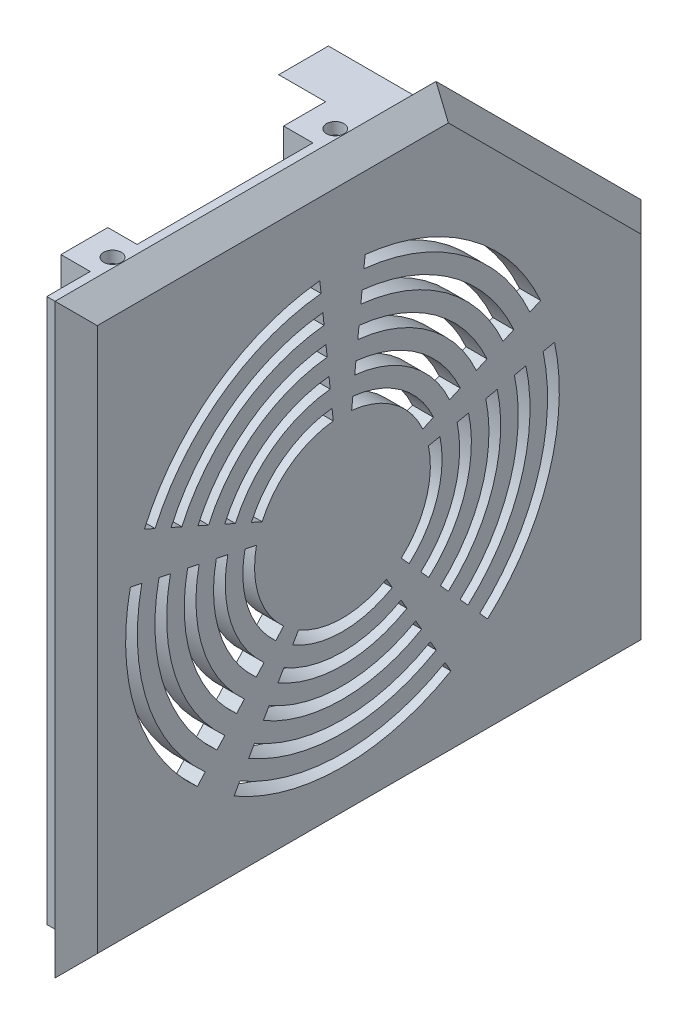
from build123d import *

# Parameters (mm, degrees)
BOSS_EXTRUDE1_DEPTH       = 3.6
BOSS_EXTRUDE1_TAPER       = 45
EXTRUDE_THIN2_DEPTH       = 5
SKETCH5_W                 = 8
SKETCH5_H                 = 8
BOSS_EXTRUDE2_DEPTH       = 10
CUT_EXTRUDE1_DEPTH        = 4
F_3_0MM_DOWEL_HOLE1_D     = 3
F_3_0MM_DOWEL_HOLE1_DEPTH = 8
F_3_0MM_DOWEL_HOLE1_TIP   = 0.901290929
SKETCH11_W                = 8
SKETCH11_H                = 8
BOSS_EXTRUDE3_DEPTH       = 10
CUT_EXTRUDE2_DEPTH        = 4
F_3_0MM_DOWEL_HOLE2_D     = 3
F_3_0MM_DOWEL_HOLE2_DEPTH = 8
F_3_0MM_DOWEL_HOLE2_TIP   = 0.901290929
BOSS_EXTRUDE4_DEPTH       = 18
CUT_EXTRUDE3_DEPTH        = 6
CUT_EXTRUDE4_DEPTH        = 3.6


with BuildPart() as part:
    # Sketch1 → Boss-Extrude1 (new body)
    with BuildSketch(Plane(origin=(0, 0, 0), x_dir=(0, 0, -1), z_dir=(1, 0, 0))):
        Polygon((-8.447488584, 4.892694064), (-8.447488584, -95.107305936), (91.552511416, -95.107305936), (91.552511416, -30.107305936), (56.552511416, 4.892694064), align=None)
    extrude(amount=BOSS_EXTRUDE1_DEPTH, taper=BOSS_EXTRUDE1_TAPER)

    # Sketch2 → Extrude-Thin2 (add)
    with BuildSketch(Plane.ZY):
        Polygon((-56.192713441, 1.292694064), (4.847488584, 1.292694064), (4.847488584, -91.507305936), (-87.952511416, -91.507305936), (-87.952511416, -30.467103911), align=None)
        Polygon((-54.535859191, -2.707305936), (0.847488584, -2.707305936), (0.847488584, -87.507305936), (-83.952511416, -87.507305936), (-83.952511416, -32.12395816), align=None, mode=Mode.SUBTRACT)
    extrude(amount=EXTRUDE_THIN2_DEPTH)

    # Sketch5 → Boss-Extrude2 (add)
    with BuildSketch(Plane.ZY):
        with Locations((-66.552511416, -87.507305936)):
            Rectangle(SKETCH5_W, SKETCH5_H)
        with Locations((-16.552511416, -87.507305936)):
            Rectangle(SKETCH5_W, SKETCH5_H)
    extrude(amount=BOSS_EXTRUDE2_DEPTH)

    # Sketch6 → Cut-Extrude1 (cut)
    with BuildSketch(Plane(origin=(0, -85.507305936, 0), x_dir=(1, 0, 0), z_dir=(0, 1, 0))):
        Polygon((-10, 69.552511416), (-3.732050808, 69.552511416), (-2, 66.552511416), (-3.732050808, 63.552511416), (-10, 63.552511416), align=None)
        Polygon((-10, 19.552511416), (-3.732050808, 19.552511416), (-2, 16.552511416), (-3.732050808, 13.552511416), (-10, 13.552511416), align=None)
    extrude(amount=-CUT_EXTRUDE1_DEPTH, mode=Mode.SUBTRACT)

    # Ø3.0mm Dowel Hole1
    with Locations(Plane(origin=(0, -91.507305936, 0), x_dir=(-1, 0, 0), z_dir=(0, -1, 0))):
        with Locations((5.2, 66.552511416), (5.2, 16.552511416)):
            Hole(F_3_0MM_DOWEL_HOLE1_D / 2, depth=F_3_0MM_DOWEL_HOLE1_DEPTH)
            with Locations((0, 0, -(F_3_0MM_DOWEL_HOLE1_DEPTH + F_3_0MM_DOWEL_HOLE1_TIP / 2))):  # 118° drill point
                Cone(0, F_3_0MM_DOWEL_HOLE1_D / 2, F_3_0MM_DOWEL_HOLE1_TIP, mode=Mode.SUBTRACT)

    # Sketch11 → Boss-Extrude3 (add)
    with BuildSketch(Plane.ZY):
        with Locations((-6.552511416, -2.707305936)):
            Rectangle(SKETCH11_W, SKETCH11_H)
        with Locations((-44.552511416, -2.707305936)):
            Rectangle(SKETCH11_W, SKETCH11_H)
    extrude(amount=BOSS_EXTRUDE3_DEPTH)

    # Sketch13 → Cut-Extrude2 (cut)
    with BuildSketch(Plane(origin=(0, -0.707305936, 0), x_dir=(1, 0, 0), z_dir=(0, 1, 0))):
        Polygon((-10, 9.552511416), (-3.732050808, 9.552511416), (-2, 6.552511416), (-3.732050808, 3.552511416), (-10, 3.552511416), align=None)
        Polygon((-10, 47.552511416), (-3.732050808, 47.552511416), (-2, 44.552511416), (-3.732050808, 41.552511416), (-10, 41.552511416), align=None)
    extrude(amount=-CUT_EXTRUDE2_DEPTH, mode=Mode.SUBTRACT)

    # Ø3.0mm Dowel Hole2
    with Locations(Plane(origin=(0, 1.292694064, 0), x_dir=(1, 0, 0), z_dir=(0, 1, 0))):
        with Locations((-122.185263722, 54.052726222), (-5.2, 44.552511416), (-5.2, 6.552511416)):
            Hole(F_3_0MM_DOWEL_HOLE2_D / 2, depth=F_3_0MM_DOWEL_HOLE2_DEPTH)
            with Locations((0, 0, -(F_3_0MM_DOWEL_HOLE2_DEPTH + F_3_0MM_DOWEL_HOLE2_TIP / 2))):  # 118° drill point
                Cone(0, F_3_0MM_DOWEL_HOLE2_D / 2, F_3_0MM_DOWEL_HOLE2_TIP, mode=Mode.SUBTRACT)

    # Sketch16 → Boss-Extrude4 (add)
    with BuildSketch(Plane.ZY):
        Polygon((-47.707432067, 1.292694064), (-87.952511416, -38.952385285), (-87.952511416, -30.467103911), (-56.192713441, 1.292694064), align=None)
    extrude(amount=BOSS_EXTRUDE4_DEPTH)

    # Sketch17 → Cut-Extrude3 (cut)
    with BuildSketch(Plane.ZY.offset(18)):
        Polygon((-57.223370023, -2.849232356), (-55.809156461, -4.263445918), (-82.396371434, -30.850660891), (-83.810584996, -29.436447328), align=None)
    extrude(amount=-CUT_EXTRUDE3_DEPTH, mode=Mode.SUBTRACT)

    # Sketch18 → Cut-Extrude4 (cut)
    with BuildSketch(Plane.ZY):
        with BuildLine():
            Line((-29.489824704, -60.844573588), (-28.489824704, -62.576624396))
            ThreePointArc((-28.489824704, -62.576624396), (-36.989824704, -64.854192532), (-45.489824704, -62.576624396))
            Line((-45.489824704, -62.576624396), (-44.489824704, -60.844573588))
            ThreePointArc((-44.489824704, -60.844573588), (-36.989824704, -62.854192532), (-29.489824704, -60.844573588))
        make_face()
        with BuildLine():
            Line((-26.989824704, -65.174700607), (-25.989824704, -66.906751415))
            ThreePointArc((-25.989824704, -66.906751415), (-36.989824704, -69.854192532), (-47.989824704, -66.906751415))
            Line((-47.989824704, -66.906751415), (-46.989824704, -65.174700607))
            ThreePointArc((-46.989824704, -65.174700607), (-36.989824704, -67.854192532), (-26.989824704, -65.174700607))
        make_face()
        with BuildLine():
            Line((-24.489824704, -69.504827626), (-23.489824704, -71.236878434))
            ThreePointArc((-23.489824704, -71.236878434), (-36.989824704, -74.854192532), (-50.489824704, -71.236878434))
            Line((-50.489824704, -71.236878434), (-49.489824704, -69.504827626))
            ThreePointArc((-49.489824704, -69.504827626), (-36.989824704, -72.854192532), (-24.489824704, -69.504827626))
        make_face()
        with BuildLine():
            Line((-21.989824704, -73.834954645), (-20.989824704, -75.567005453))
            ThreePointArc((-20.989824704, -75.567005453), (-36.989824704, -79.854192532), (-52.989824704, -75.567005453))
            Line((-52.989824704, -75.567005453), (-51.989824704, -73.834954645))
            ThreePointArc((-51.989824704, -73.834954645), (-36.989824704, -77.854192532), (-21.989824704, -73.834954645))
        make_face()
        with BuildLine():
            Line((-19.489824704, -78.165081664), (-18.489824704, -79.897132472))
            ThreePointArc((-18.489824704, -79.897132472), (-36.989824704, -84.854192532), (-55.489824704, -79.897132472))
            Line((-55.489824704, -79.897132472), (-54.489824704, -78.165081664))
            ThreePointArc((-54.489824704, -78.165081664), (-36.989824704, -82.854192532), (-19.489824704, -78.165081664))
        make_face()
        with BuildLine():
            Line((-47.026783799, -59.001364914), (-48.365045012, -60.487654565))
            ThreePointArc((-48.365045012, -60.487654565), (-53.157785481, -53.107481436), (-53.618333916, -44.319693788))
            Line((-53.618333916, -44.319693788), (-51.662038715, -44.735517169))
            ThreePointArc((-51.662038715, -44.735517169), (-51.255672448, -52.489447447), (-47.026783799, -59.001364914))
        make_face()
        with BuildLine():
            Line((-50.372436831, -62.717089041), (-51.710698043, -64.203378692))
            ThreePointArc((-51.710698043, -64.203378692), (-57.913068062, -54.652566408), (-58.50907192, -43.280135334))
            Line((-58.50907192, -43.280135334), (-56.552776718, -43.695958715))
            ThreePointArc((-56.552776718, -43.695958715), (-56.010955029, -54.034532419), (-50.372436831, -62.717089041))
        make_face()
        with BuildLine():
            Line((-53.718089863, -66.432813168), (-55.056351075, -67.919102819))
            ThreePointArc((-55.056351075, -67.919102819), (-62.668350643, -56.19765138), (-63.399809923, -42.240576879))
            Line((-63.399809923, -42.240576879), (-61.443514722, -42.656400261))
            ThreePointArc((-61.443514722, -42.656400261), (-60.766237611, -55.579617391), (-53.718089863, -66.432813168))
        make_face()
        with BuildLine():
            Line((-57.063742894, -70.148537296), (-58.402004107, -71.634826947))
            ThreePointArc((-58.402004107, -71.634826947), (-67.423633225, -57.742736352), (-68.290547927, -41.201018425))
            Line((-68.290547927, -41.201018425), (-66.334252726, -41.616841807))
            ThreePointArc((-66.334252726, -41.616841807), (-65.521520192, -57.124702363), (-57.063742894, -70.148537296))
        make_face()
        with BuildLine():
            Line((-60.409395926, -73.864261423), (-61.747657139, -75.350551074))
            ThreePointArc((-61.747657139, -75.350551074), (-72.178915806, -59.287821323), (-73.181285931, -40.161459971))
            Line((-73.181285931, -40.161459971), (-71.224990729, -40.577283353))
            ThreePointArc((-71.224990729, -40.577283353), (-70.276802774, -58.669787335), (-60.409395926, -73.864261423))
        make_face()
        with BuildLine():
            Line((-50.693006568, -41.753142885), (-52.520097483, -40.939669599))
            ThreePointArc((-52.520097483, -40.939669599), (-46.982173993, -34.100903627), (-38.766808579, -30.94732031))
            Line((-38.766808579, -30.94732031), (-38.557751653, -32.936364101))
            ThreePointArc((-38.557751653, -32.936364101), (-45.806603488, -35.718937616), (-50.693006568, -41.753142885))
        make_face()
        with BuildLine():
            Line((-55.260733856, -39.71945967), (-57.087824772, -38.905986384))
            ThreePointArc((-57.087824772, -38.905986384), (-49.921100254, -30.055818655), (-39.289450895, -25.974710833))
            Line((-39.289450895, -25.974710833), (-39.080393969, -27.963754624))
            ThreePointArc((-39.080393969, -27.963754624), (-48.745529749, -31.673852644), (-55.260733856, -39.71945967))
        make_face()
        with BuildLine():
            Line((-59.828461145, -37.685776455), (-61.65555206, -36.872303168))
            ThreePointArc((-61.65555206, -36.872303168), (-52.860026515, -26.010733683), (-39.812093212, -21.002101357))
            Line((-39.812093212, -21.002101357), (-39.603036285, -22.991145147))
            ThreePointArc((-39.603036285, -22.991145147), (-51.684456011, -27.628767672), (-59.828461145, -37.685776455))
        make_face()
        with BuildLine():
            Line((-64.396188433, -35.652093239), (-66.223279348, -34.838619953))
            ThreePointArc((-66.223279348, -34.838619953), (-55.798952777, -21.965648712), (-40.334735528, -16.02949188))
            Line((-40.334735528, -16.02949188), (-40.125678602, -18.01853567))
            ThreePointArc((-40.125678602, -18.01853567), (-54.623382272, -23.5836827), (-64.396188433, -35.652093239))
        make_face()
        with BuildLine():
            Line((-68.963915721, -33.618410024), (-70.791006636, -32.804936738))
            ThreePointArc((-70.791006636, -32.804936738), (-58.737879038, -17.92056374), (-40.857377844, -11.056882403))
            Line((-40.857377844, -11.056882403), (-40.648320918, -13.045926194))
            ThreePointArc((-40.648320918, -13.045926194), (-57.562308534, -19.538597728), (-68.963915721, -33.618410024))
        make_face()
        with BuildLine():
            Line((-35.421897755, -32.936364101), (-35.212840828, -30.94732031))
            ThreePointArc((-35.212840828, -30.94732031), (-26.997475415, -34.100903627), (-21.459551924, -40.939669599))
            Line((-21.459551924, -40.939669599), (-23.286642839, -41.753142885))
            ThreePointArc((-23.286642839, -41.753142885), (-28.173045919, -35.718937616), (-35.421897755, -32.936364101))
        make_face()
        with BuildLine():
            Line((-34.899255438, -27.963754624), (-34.690198512, -25.974710833))
            ThreePointArc((-34.690198512, -25.974710833), (-24.058549153, -30.055818655), (-16.891824635, -38.905986384))
            Line((-16.891824635, -38.905986384), (-18.718915551, -39.71945967))
            ThreePointArc((-18.718915551, -39.71945967), (-25.234119658, -31.673852644), (-34.899255438, -27.963754624))
        make_face()
        with BuildLine():
            Line((-34.376613122, -22.991145147), (-34.167556195, -21.002101357))
            ThreePointArc((-34.167556195, -21.002101357), (-21.119622892, -26.010733683), (-12.324097347, -36.872303168))
            Line((-12.324097347, -36.872303168), (-14.151188262, -37.685776455))
            ThreePointArc((-14.151188262, -37.685776455), (-22.295193396, -27.628767672), (-34.376613122, -22.991145147))
        make_face()
        with BuildLine():
            Line((-33.853970806, -18.01853567), (-33.644913879, -16.02949188))
            ThreePointArc((-33.644913879, -16.02949188), (-18.18069663, -21.965648712), (-7.756370059, -34.838619953))
            Line((-7.756370059, -34.838619953), (-9.583460974, -35.652093239))
            ThreePointArc((-9.583460974, -35.652093239), (-19.356267135, -23.5836827), (-33.853970806, -18.01853567))
        make_face()
        with BuildLine():
            Line((-33.331328489, -13.045926194), (-33.122271563, -11.056882403))
            ThreePointArc((-33.122271563, -11.056882403), (-15.241770369, -17.92056374), (-3.188642771, -32.804936738))
            Line((-3.188642771, -32.804936738), (-5.015733686, -33.618410024))
            ThreePointArc((-5.015733686, -33.618410024), (-16.417340873, -19.538597728), (-33.331328489, -13.045926194))
        make_face()
        with BuildLine():
            Line((-22.317610693, -44.735517169), (-20.361315491, -44.319693788))
            ThreePointArc((-20.361315491, -44.319693788), (-20.821863927, -53.107481436), (-25.614604395, -60.487654565))
            Line((-25.614604395, -60.487654565), (-26.952865608, -59.001364914))
            ThreePointArc((-26.952865608, -59.001364914), (-22.723976959, -52.489447447), (-22.317610693, -44.735517169))
        make_face()
        with BuildLine():
            Line((-17.426872689, -43.695958715), (-15.470577487, -43.280135334))
            ThreePointArc((-15.470577487, -43.280135334), (-16.066581345, -54.652566408), (-22.268951364, -64.203378692))
            Line((-22.268951364, -64.203378692), (-23.607212576, -62.717089041))
            ThreePointArc((-23.607212576, -62.717089041), (-17.968694378, -54.034532419), (-17.426872689, -43.695958715))
        make_face()
        with BuildLine():
            Line((-12.536134685, -42.656400261), (-10.579839484, -42.240576879))
            ThreePointArc((-10.579839484, -42.240576879), (-11.311298764, -56.19765138), (-18.923298332, -67.919102819))
            Line((-18.923298332, -67.919102819), (-20.261559545, -66.432813168))
            ThreePointArc((-20.261559545, -66.432813168), (-13.213411796, -55.579617391), (-12.536134685, -42.656400261))
        make_face()
        with BuildLine():
            Line((-7.645396682, -41.616841807), (-5.68910148, -41.201018425))
            ThreePointArc((-5.68910148, -41.201018425), (-6.556016182, -57.742736352), (-15.5776453, -71.634826947))
            Line((-15.5776453, -71.634826947), (-16.915906513, -70.148537296))
            ThreePointArc((-16.915906513, -70.148537296), (-8.458129215, -57.124702363), (-7.645396682, -41.616841807))
        make_face()
        with BuildLine():
            Line((-2.754658678, -40.577283353), (-0.798363476, -40.161459971))
            ThreePointArc((-0.798363476, -40.161459971), (-1.800733601, -59.287821323), (-12.231992268, -75.350551074))
            Line((-12.231992268, -75.350551074), (-13.570253481, -73.864261423))
            ThreePointArc((-13.570253481, -73.864261423), (-3.702846633, -58.669787335), (-2.754658678, -40.577283353))
        make_face()
    extrude(amount=-CUT_EXTRUDE4_DEPTH, mode=Mode.SUBTRACT)


solid = part.part
